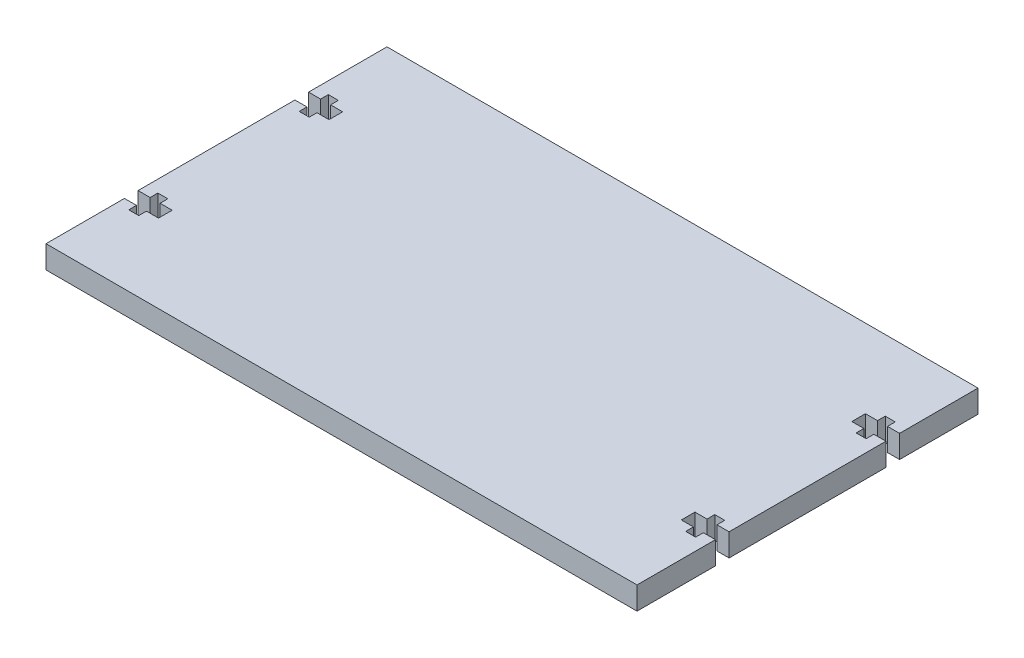
from build123d import *

# Parameters (mm, degrees)
SKETCH1_W            = 165.1
SKETCH1_H            = 95.25
BOSS_EXTRUDE1_DEPTH  = 6.35
CUT_EXTRUDE1_DEPTH   = 96.514216874
MIRROR2_COPY_1_DEPTH = 96.514216874


with BuildPart() as part:
    # Sketch1 → Boss-Extrude1 (new body)
    with BuildSketch(Plane(origin=(0, 0, 0), x_dir=(1, 0, 0), z_dir=(0, 1, 0))):
        Rectangle(SKETCH1_W, SKETCH1_H)
    extrude(amount=BOSS_EXTRUDE1_DEPTH)

    # Sketch2 → Cut-Extrude1 (cut, through all)
    with BuildSketch(Plane(origin=(0, 6.35, 0), x_dir=(1, 0, 0), z_dir=(0, 1, 0))):
        Polygon((82.55, -21.9075), (82.55, -25.7175), (79.1845, -25.7175), (79.1845, -27.8765), (76.3905, -27.8765), (76.3905, -25.7175), (73.025, -25.7175), (73.025, -21.9075), (76.3905, -21.9075), (76.3905, -19.7485), (79.1845, -19.7485), (79.1845, -21.9075), align=None)
    cut_extrude1 = extrude(amount=-CUT_EXTRUDE1_DEPTH, mode=Mode.SUBTRACT)

    # Mirror1: Cut-Extrude1 across plane
    add(cut_extrude1.mirror(Plane.XY), mode=Mode.SUBTRACT)

    # Mirror2: Cut-Extrude1 across plane
    add(cut_extrude1.mirror(Plane(origin=(0, 0, 0), x_dir=(0, 0, 1), z_dir=(1, 0, 0))), mode=Mode.SUBTRACT)

    # Mirror2 copy 1 sketch → Mirror2 copy 1 (cut, through all)
    with BuildSketch(Plane(origin=(0, 6.35, 0), x_dir=(-1, 0, 0), z_dir=(0, 1, 0))):
        Polygon((82.55, -21.9075), (82.55, -25.7175), (79.1845, -25.7175), (79.1845, -27.8765), (76.3905, -27.8765), (76.3905, -25.7175), (73.025, -25.7175), (73.025, -21.9075), (76.3905, -21.9075), (76.3905, -19.7485), (79.1845, -19.7485), (79.1845, -21.9075), align=None)
    extrude(amount=-MIRROR2_COPY_1_DEPTH, mode=Mode.SUBTRACT)


solid = part.part
